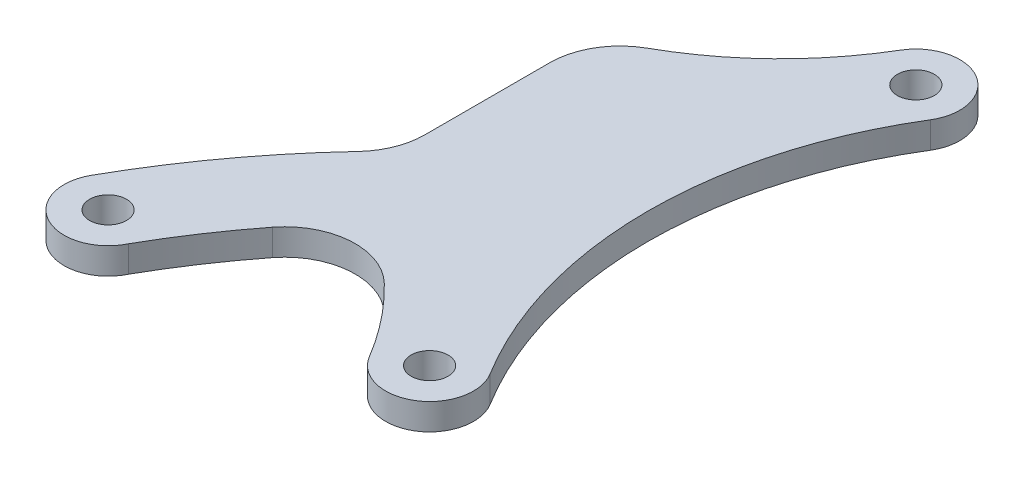
from build123d import *

# Parameters (mm, degrees)
SKETCH1_R           = 2.1
BOSS_EXTRUDE1_DEPTH = 3
FILLET1_R           = 8


with BuildPart() as part:
    # Sketch1 → Boss-Extrude1 (new body)
    with BuildSketch(Plane(origin=(0, 0, 0), x_dir=(1, 0, 0), z_dir=(0, 1, 0))):
        with BuildLine():
            ThreePointArc((-6.113719472, -32.751050787), (-0.724273586, -24.461432648), (5.649824002, -16.902677739))
            ThreePointArc((5.649824002, -16.902677739), (12.975948477, -22.768180875), (18.703056171, -30.202995218))
            ThreePointArc((18.703056171, -30.202995218), (25.587038372, -31.925076677), (27.260231116, -25.029048724))
            ThreePointArc((27.260231116, -25.029048724), (20.185963894, 0), (27.260231116, 25.029048724))
            ThreePointArc((27.260231116, 25.029048724), (25.587038372, 31.925076677), (18.703056171, 30.202995218))
            ThreePointArc((18.703056171, 30.202995218), (10.659672329, 20.591511651), (0, 14))
            Line((0, 14), (0, -8.396398763))
            ThreePointArc((0, -8.396398763), (-8.177458209, -17.750627647), (-14.984135407, -28.14493216))
            ThreePointArc((-14.984135407, -28.14493216), (-12.92577576, -35.025301553), (-6.113719472, -32.751050787))
        make_face()
        with Locations(Location((-10.621571061, -30.587887812, 0), (0, 0, 270))):
            Circle(SKETCH1_R, mode=Mode.SUBTRACT)
        with Locations(Location((23, -27.646381495, 0), (0, 0, 270))):
            Circle(SKETCH1_R, mode=Mode.SUBTRACT)
        with Locations(Location((23, 27.646381495, 0), (0, 0, 270))):
            Circle(SKETCH1_R, mode=Mode.SUBTRACT)
    extrude(amount=BOSS_EXTRUDE1_DEPTH)

    # Fillet1
    fillet1_edges = [part.edges().sort_by_distance(p)[0] for p in [
        (0, 1.5, -14),
        (5.649824002, 1.5, 16.902677739),
        (0, 1.5, 8.396398763),
    ]]
    fillet(fillet1_edges, radius=FILLET1_R)


solid = part.part
